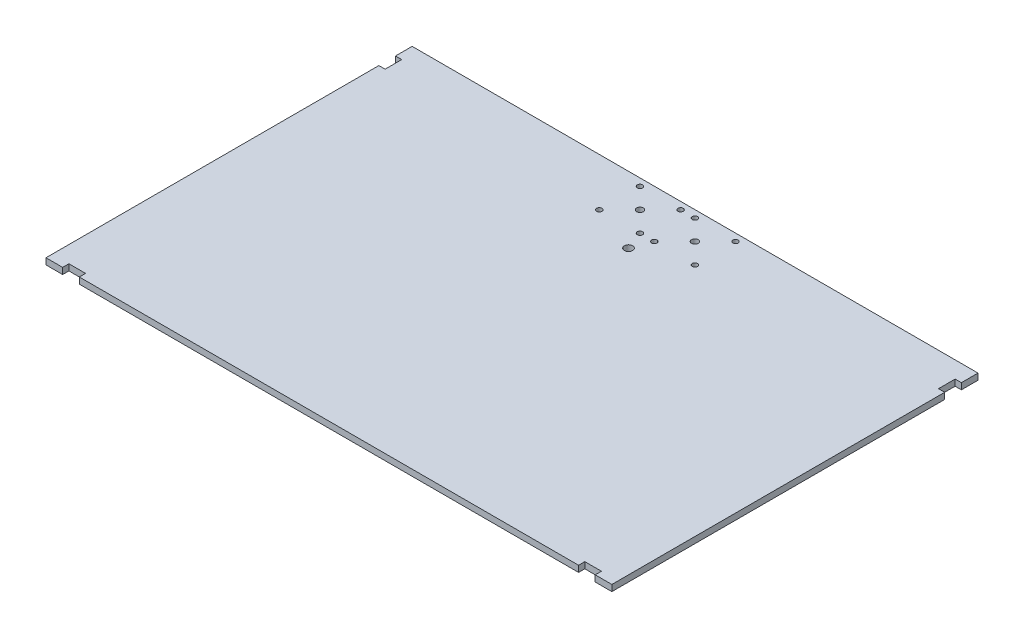
from build123d import *

# Parameters (mm, degrees)
SKETCH1_R           = 3.175
SKETCH1_R_2         = 2.032
SKETCH1_R_3         = 2.54
BOSS_EXTRUDE1_DEPTH = 4.7625


with BuildPart() as part:
    # Sketch1 → Boss-Extrude1 (new body)
    with BuildSketch(Plane(origin=(0, 0, 0), x_dir=(1, 0, 0), z_dir=(0, 1, 0))):
        Polygon((0, 0), (12.7, 0), (12.7, 4.7625), (25.4, 4.7625), (25.4, 0), (406.4, 0), (406.4, 4.7625), (419.1, 4.7625), (419.1, 0), (431.8, 0), (431.8, 254), (427.0375, 254), (427.0375, 266.7), (431.8, 266.7), (431.8, 279.4), (0, 279.4), (0, 266.7), (4.7625, 266.7), (4.7625, 254), (0, 254), align=None)
        with Locations(Location((215.9, 228.6, 0), (0, 0, 90))):
            Circle(SKETCH1_R, mode=Mode.SUBTRACT)
        with Locations(Location((210.439, 273.812, 0), (0, 0, 90))):
            Circle(SKETCH1_R_2, mode=Mode.SUBTRACT)
        with Locations(Location((179.451, 273.812, 0), (0, 0, 90))):
            Circle(SKETCH1_R_2, mode=Mode.SUBTRACT)
        with Locations(Location((252.349, 273.812, 0), (0, 0, 90))):
            Circle(SKETCH1_R_2, mode=Mode.SUBTRACT)
        with Locations(Location((221.361, 273.812, 0), (0, 0, 90))):
            Circle(SKETCH1_R_2, mode=Mode.SUBTRACT)
        with Locations(Location((194.945, 258.318, 0), (0, 0, 90))):
            Circle(SKETCH1_R_3, mode=Mode.SUBTRACT)
        with Locations(Location((210.439, 242.824, 0), (0, 0, 90))):
            Circle(SKETCH1_R_2, mode=Mode.SUBTRACT)
        with Locations(Location((179.451, 242.824, 0), (0, 0, 90))):
            Circle(SKETCH1_R_2, mode=Mode.SUBTRACT)
        with Locations(Location((221.361, 242.824, 0), (0, 0, 90))):
            Circle(SKETCH1_R_2, mode=Mode.SUBTRACT)
        with Locations(Location((236.855, 258.318, 0), (0, 0, 90))):
            Circle(SKETCH1_R_3, mode=Mode.SUBTRACT)
        with Locations(Location((252.349, 242.824, 0), (0, 0, 90))):
            Circle(SKETCH1_R_2, mode=Mode.SUBTRACT)
    extrude(amount=BOSS_EXTRUDE1_DEPTH)


solid = part.part
